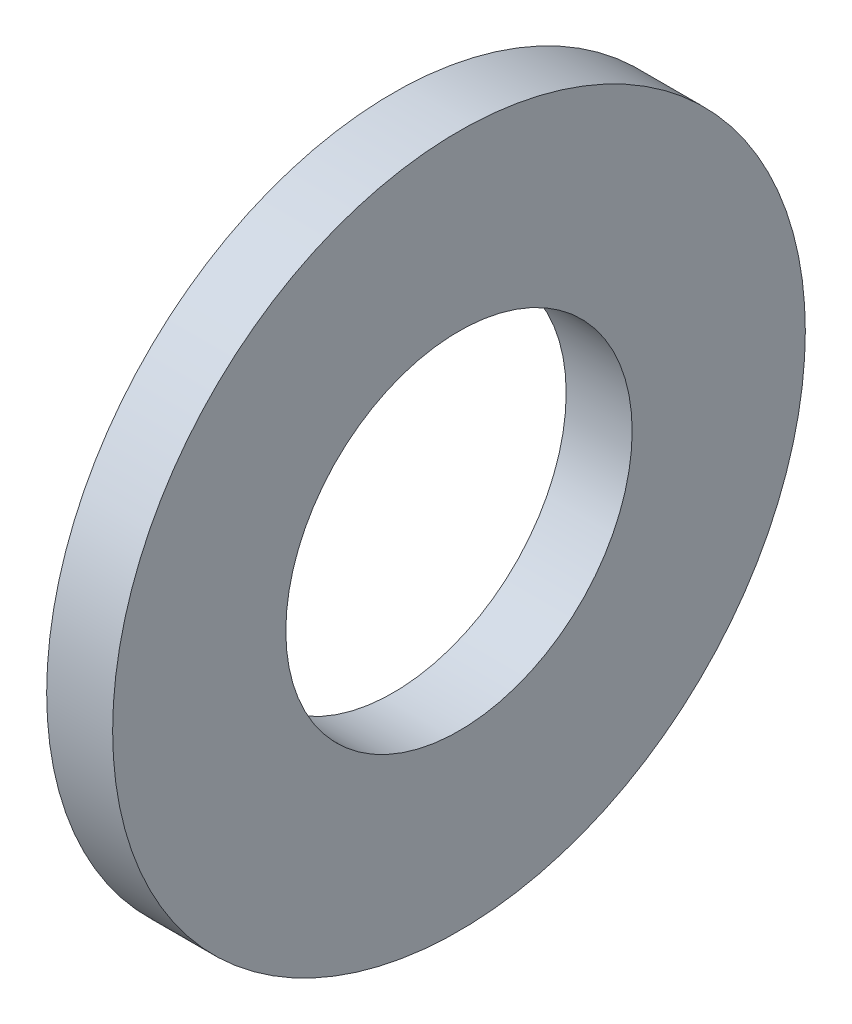
from build123d import *

# Parameters (mm, degrees)
SKETCH1_W = 2
SKETCH1_H = 5.25


with BuildPart() as part:
    # Sketch1 → Base-Revolve (revolve)
    with BuildSketch(Plane.XY, mode=Mode.PRIVATE) as base_revolve_sk:
        with Locations((-1, 7.875)):
            Rectangle(SKETCH1_W, SKETCH1_H)
    revolve(base_revolve_sk.sketch.rotate(Axis((-34.925, 0, 0), (1, 0, 0)), 90), axis=Axis((-34.925, 0, 0), (1, 0, 0)))


solid = part.part
